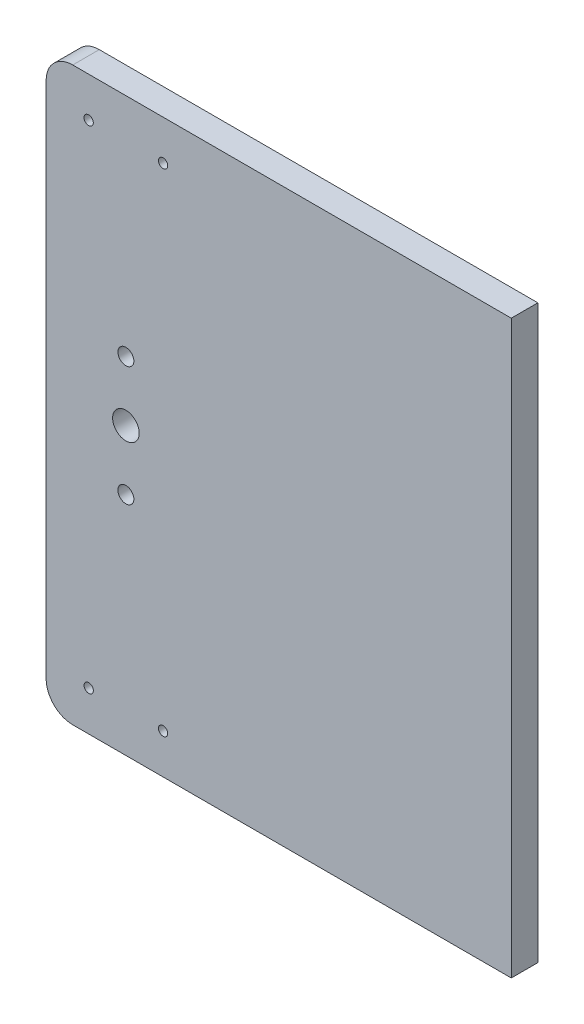
from build123d import *

# Parameters (mm, degrees)
SKETCH_1_W      = 350
SKETCH_1_H      = 430
SKETCH_1_R      = 3.5
SKETCH_1_R_2    = 6
SKETCH_1_R_3    = 10
EXTRUDE_1_DEPTH = 20
FILLET_1_R      = 20


with BuildPart() as part:
    # Эскиз1 → Бобышка-Вытянуть1 (new body)
    with BuildSketch(Plane.XY):
        with Locations((115, 0)):
            Rectangle(SKETCH_1_W, SKETCH_1_H)
        with Locations((-28, -185)):
            Circle(SKETCH_1_R, mode=Mode.SUBTRACT)
        with Locations((28, -185)):
            Circle(SKETCH_1_R, mode=Mode.SUBTRACT)
        with Locations((0, -45)):
            Circle(SKETCH_1_R_2, mode=Mode.SUBTRACT)
        Circle(SKETCH_1_R_3, mode=Mode.SUBTRACT)
        with Locations((0, 45)):
            Circle(SKETCH_1_R_2, mode=Mode.SUBTRACT)
        with Locations((-28, 185)):
            Circle(SKETCH_1_R, mode=Mode.SUBTRACT)
        with Locations((28, 185)):
            Circle(SKETCH_1_R, mode=Mode.SUBTRACT)
    extrude(amount=EXTRUDE_1_DEPTH)

    # Скругление1
    fillet_1_edges = [part.edges().sort_by_distance(p)[0] for p in [
        (-60, 215, 10),
        (-60, -215, 10),
    ]]
    fillet(fillet_1_edges, radius=FILLET_1_R)


solid = part.part
